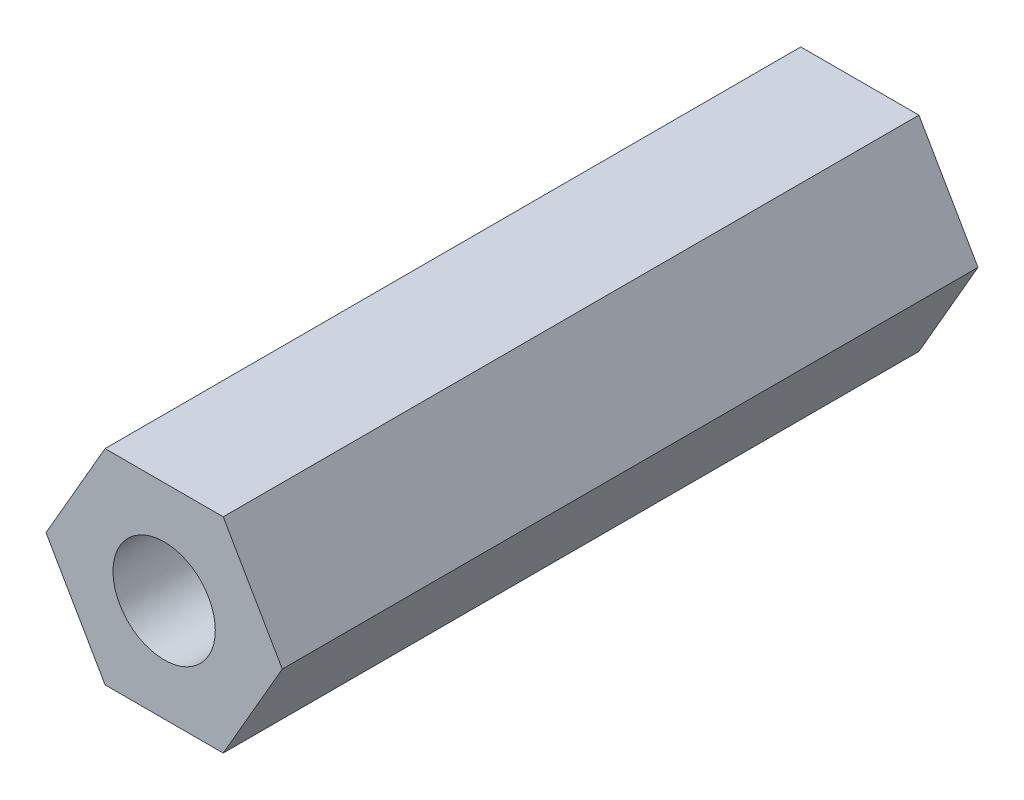
from build123d import *

# Parameters (mm, degrees)
SKETCH1_R           = 3.175
BOSS_EXTRUDE1_DEPTH = 43.18


with BuildPart() as part:
    # Sketch1 → Boss-Extrude1 (new body)
    with BuildSketch(Plane.XY):
        Polygon((7.332348419, 0), (3.666174209, 6.35), (-3.666174209, 6.35), (-7.332348419, 0), (-3.666174209, -6.35), (3.666174209, -6.35), align=None)
        Circle(SKETCH1_R, mode=Mode.SUBTRACT)
    extrude(amount=BOSS_EXTRUDE1_DEPTH)


solid = part.part
